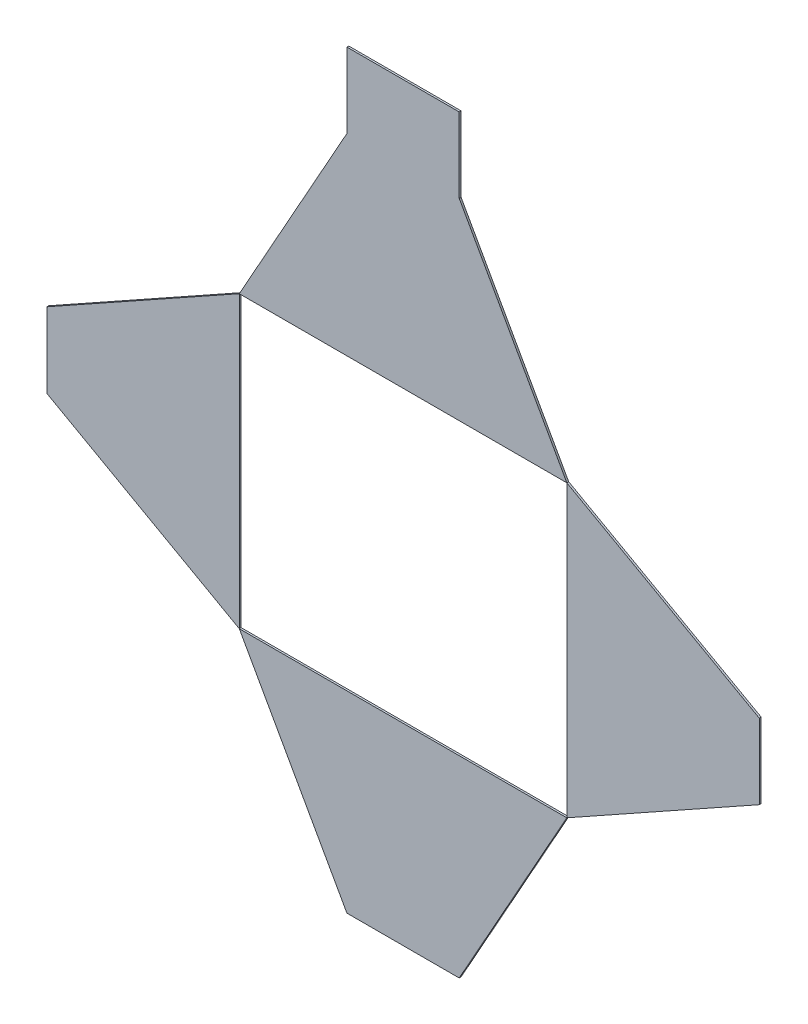
from build123d import *

# Parameters (mm, degrees)
SKETCH1_W           = 120
SKETCH1_H           = 80
BOSS_EXTRUDE2_DEPTH = 2


with BuildPart() as part:
    # Sketch1 → Boss-Extrude2 (new body)
    with BuildSketch(Plane.XY):
        with Locations((0, 400.741318164)):
            Rectangle(SKETCH1_W, SKETCH1_H)
        Polygon((60, 360.741318164), (175, 155), (-175, 155), (-60, 360.741318164), align=None)
        Polygon((380.741318164, -40), (175, -155), (175, 155), (380.741318164, 40), align=None)
        Polygon((-60, -360.741318164), (-175, -155), (175, -155), (60, -360.741318164), align=None)
        Polygon((-175, -155), (-175, 155), (-380.741318164, 40), (-380.741318164, -40), align=None)
    extrude(amount=BOSS_EXTRUDE2_DEPTH)


solid = part.part
